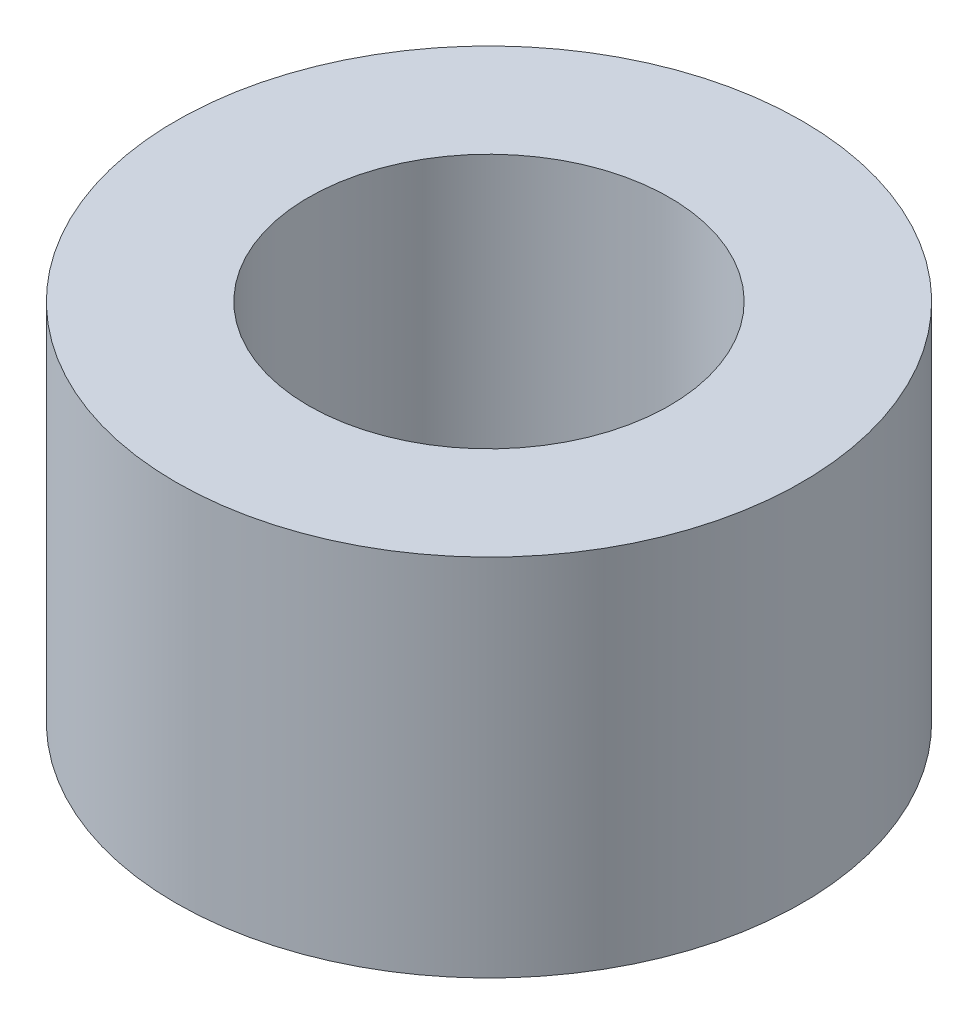
from build123d import *

# Parameters (mm, degrees)
SKETCH1_R           = 4.293367347
SKETCH1_R_2         = 2.475
BOSS_EXTRUDE1_DEPTH = 5


with BuildPart() as part:
    # Sketch1 → Boss-Extrude1 (new body)
    with BuildSketch(Plane(origin=(0, 0, 0), x_dir=(1, 0, 0), z_dir=(0, 1, 0))):
        with Locations(Location((0, 0, 0), (0, 0, 270))):
            Circle(SKETCH1_R)
        with Locations(Location((0, 0, 0), (0, 0, 270))):
            Circle(SKETCH1_R_2, mode=Mode.SUBTRACT)
    extrude(amount=BOSS_EXTRUDE1_DEPTH)


solid = part.part
